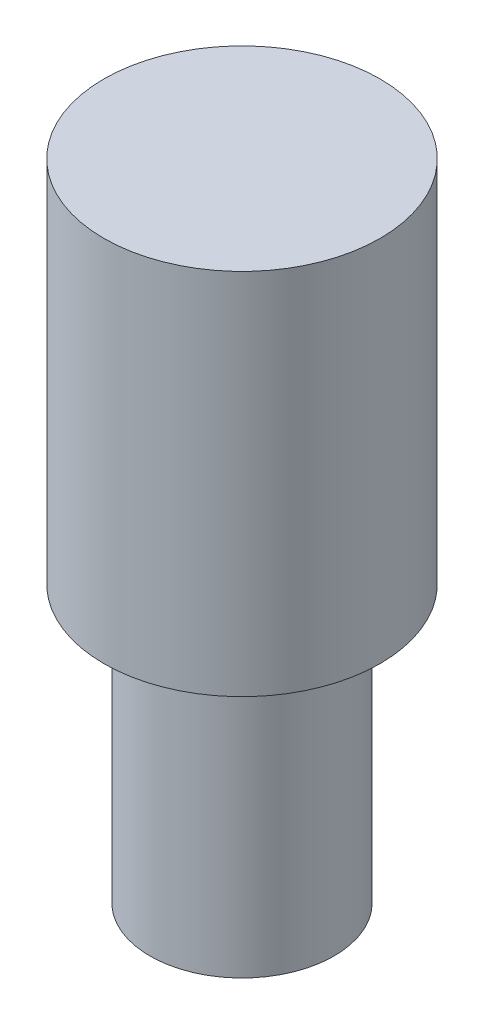
from build123d import *


with BuildPart() as part:
    # Sketch1 → Revolve1 (revolve)
    with BuildSketch(Plane.XY, mode=Mode.PRIVATE) as revolve1_sk:
        Polygon((0, 0), (0, 7), (1.5, 7), (1.5, 3), (1, 3), (1, 0), align=None)
    revolve(revolve1_sk.sketch.rotate(Axis((0, 0, 0), (0, 1, 0)), 90), axis=Axis((0, 0, 0), (0, 1, 0)))


solid = part.part
